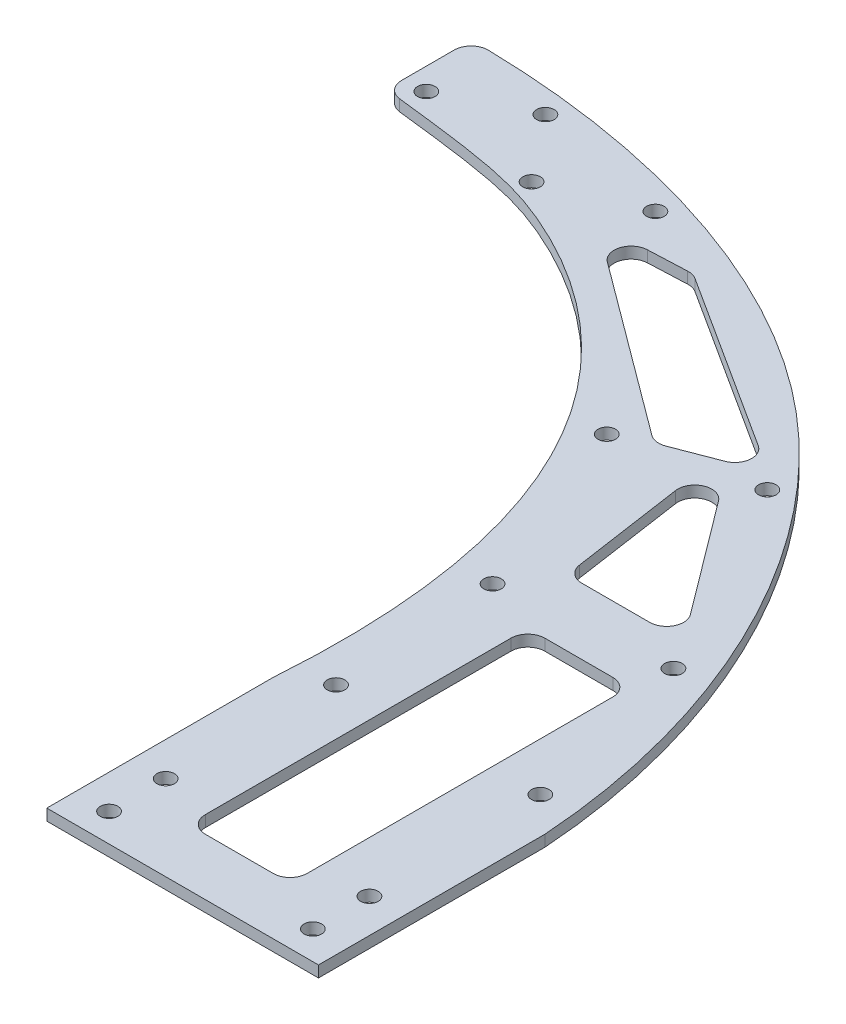
from build123d import *

# Parameters (mm, degrees)
SKETCH_1_W          = 48
SKETCH_1_H          = 40
EXTRUDE_1_DEPTH     = 2
SKETCH_2_R          = 1.55
CUT_EXTRUDE_1_DEPTH = 175.439280555
SKETCH_3_W          = 18
SKETCH_3_H          = 60
CUT_EXTRUDE_2_DEPTH = 175.439280555
FILLET_1_R          = 3
CUT_EXTRUDE_3_DEPTH = 175.439280555
FILLET_2_R          = 3
CUT_EXTRUDE_4_DEPTH = 175.439280555
FILLET_3_R          = 3
SKETCH_6_R          = 1.55
CUT_EXTRUDE_5_DEPTH = 175.439280555
FILLET_4_R          = 3


with BuildPart() as part:
    # 草图1 → 凸台-拉伸1 (new body)
    with BuildSketch(Plane(origin=(0, 0, 0), x_dir=(1, 0, 0), z_dir=(0, 1, 0))):
        with BuildLine():
            Line((0, 40), (48, 40))
            add(Edge.make_bspline(
                [(48, 40), (45.764951139, 73.28949707), (16.036127279, 137.632117299), (-51.062317124, 155.04671395), (-80, 155)],
                knots=[0, 0, 0, 0, 0.537039459, 1, 1, 1, 1], degree=3))
            Line((-80, 155), (-80, 140))
            add(Edge.make_bspline(
                [(0, 40), (4.51482928, 101.708069088), (-40.684527931, 134.921736198), (-60.886519043, 137.838657836), (-80, 140)],
                knots=[0, 0, 0, 0, 0.623950537, 0.904720498, 0.904720498, 0.904720498, 0.904720498], degree=3))
        make_face()
        with Locations((24, 20)):
            Rectangle(SKETCH_1_W, SKETCH_1_H)
    extrude(amount=EXTRUDE_1_DEPTH)

    # 草图2 → 切除-拉伸1 (cut, through all)
    with BuildSketch(Plane(origin=(0, 2, 0), x_dir=(1, 0, 0), z_dir=(0, 1, 0))):
        with Locations(Location((6, 15, 0), (0, 0, 270))):
            Circle(SKETCH_2_R)
        with Locations(Location((42, 15, 0), (0, 0, 90))):
            Circle(SKETCH_2_R)
        with Locations(Location((42, 5, 0), (0, 0, 270))):
            Circle(SKETCH_2_R)
        with Locations(Location((6, 5, 0), (0, 0, 90))):
            Circle(SKETCH_2_R)
    extrude(amount=-CUT_EXTRUDE_1_DEPTH, mode=Mode.SUBTRACT)

    # 草图3 → 切除-拉伸2 (cut, through all)
    with BuildSketch(Plane(origin=(0, 2, 0), x_dir=(1, 0, 0), z_dir=(0, 1, 0))):
        with Locations((24, 40)):
            Rectangle(SKETCH_3_W, SKETCH_3_H)
    extrude(amount=-CUT_EXTRUDE_2_DEPTH, mode=Mode.SUBTRACT)

    # 圆角1
    fillet_1_edges = [part.edges().sort_by_distance(p)[0] for p in [
        (33, 1, -70),
        (33, 1, -10),
        (15, 1, -10),
        (15, 1, -70),
    ]]
    fillet(fillet_1_edges, radius=FILLET_1_R)

    # 草图4 → 切除-拉伸3 (cut, through all)
    with BuildSketch(Plane(origin=(0, 2, 0), x_dir=(1, 0, 0), z_dir=(0, 1, 0))):
        Polygon((5.255148973, 115.791883332), (30.840281778, 81.678372925), (10.247370008, 81.678372925), align=None)
    extrude(amount=-CUT_EXTRUDE_3_DEPTH, mode=Mode.SUBTRACT)

    # 圆角2
    fillet_2_edges = [part.edges().sort_by_distance(p)[0] for p in [
        (10.247370008, 1, -81.678372925),
        (5.255148973, 1, -115.791883332),
        (30.840281778, 1, -81.678372925),
    ]]
    fillet(fillet_2_edges, radius=FILLET_2_R)

    # 草图5 → 切除-拉伸4 (cut, through all)
    with BuildSketch(Plane(origin=(0, 2, 0), x_dir=(1, 0, 0), z_dir=(0, 1, 0))):
        Polygon((-24.587676852, 138.818288759), (-40.839221994, 138.120949417), (-2.240425067, 109.493508363), (12.388978152, 115.103279522), align=None)
    extrude(amount=-CUT_EXTRUDE_4_DEPTH, mode=Mode.SUBTRACT)

    # 圆角3
    fillet_3_edges = [part.edges().sort_by_distance(p)[0] for p in [
        (-24.587676852, 1, -138.818288759),
        (12.388978152, 1, -115.103279522),
        (-2.240425067, 1, -109.493508363),
        (-40.839221994, 1, -138.120949417),
    ]]
    fillet(fillet_3_edges, radius=FILLET_3_R)

    # 草图6 → 切除-拉伸5 (cut, through all)
    with BuildSketch(Plane(origin=(0, 2, 0), x_dir=(1, 0, 0), z_dir=(0, 1, 0))):
        with Locations(Location((-76.118296747, 143.169932104, 0), (0, 0, 270))):
            Circle(SKETCH_6_R)
        with Locations(Location((-52.99849703, 138.648726826, 0), (0, 0, 270))):
            Circle(SKETCH_6_R)
        with Locations(Location((-7.730564413, 106.678081972, 0), (0, 0, 270))):
            Circle(SKETCH_6_R)
        with Locations(Location((5.068521195, 73.688071708, 0), (0, 0, 270))):
            Circle(SKETCH_6_R)
        with Locations(Location((6.702898523, 44.400963853, 0), (0, 0, 270))):
            Circle(SKETCH_6_R)
        with Locations(Location((34.000156558, 76.713375319, 0), (0, 0, 270))):
            Circle(SKETCH_6_R)
        with Locations(Location((41.522008079, 45.669395879, 0), (0, 0, 270))):
            Circle(SKETCH_6_R)
        with Locations(Location((14.954237137, 112.354667387, 0), (0, 0, 270))):
            Circle(SKETCH_6_R)
        with Locations(Location((-37.541455494, 145.068490418, 0), (0, 0, 270))):
            Circle(SKETCH_6_R)
        with Locations(Location((-62.067047187, 150.159650611, 0), (0, 0, 270))):
            Circle(SKETCH_6_R)
    extrude(amount=-CUT_EXTRUDE_5_DEPTH, mode=Mode.SUBTRACT)

    # 圆角4
    fillet_4_edges = [part.edges().sort_by_distance(p)[0] for p in [
        (-80, 1, -140),
        (-80, 1, -155),
    ]]
    fillet(fillet_4_edges, radius=FILLET_4_R)


solid = part.part
